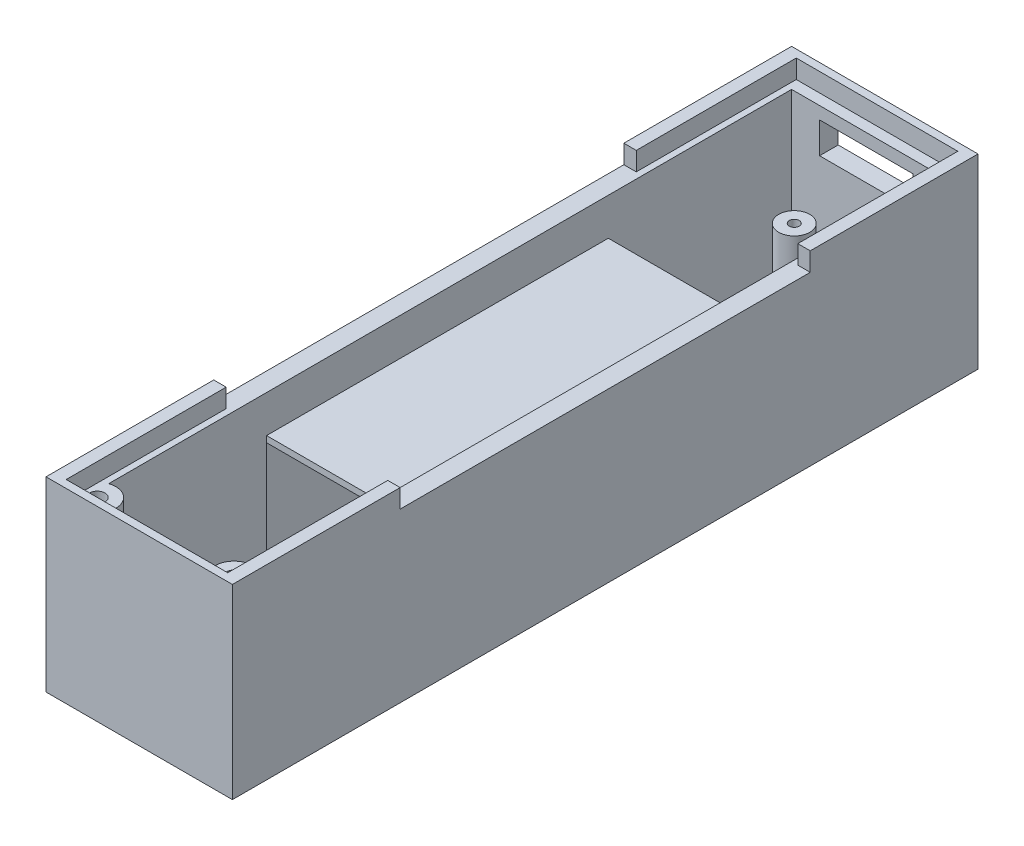
from build123d import *

# Parameters (mm, degrees)
SKETCH1_W                   = 30
SKETCH1_H                   = 120
BOSS_EXTRUDE1_DEPTH         = 30
SKETCH3_W                   = 24
SKETCH3_H                   = 114
CUT_EXTRUDE1_DEPTH          = 27.5
SKETCH4_W                   = 26
SKETCH4_H                   = 117.5
CUT_EXTRUDE2_DEPTH          = 3
SKETCH5_W                   = 66
SKETCH5_H                   = 3
CUT_EXTRUDE3_DEPTH          = 74.484692283
SKETCH6_W                   = 25
SKETCH6_H                   = 55
CUT_EXTRUDE4_DEPTH          = 20
SKETCH8_W                   = 24
SKETCH8_H                   = 55
BOSS_EXTRUDE2_DEPTH         = 1
SKETCH9_W                   = 15
SKETCH9_H                   = 5
CUT_EXTRUDE5_DEPTH          = 3
SKETCH10_R                  = 2.5
BOSS_EXTRUDE3_DEPTH         = 10
BOSS_EXTRUDE4_DEPTH         = 24.5
M2X0_4_TAPPED_HOLE1_D       = 1.6
M2X0_4_TAPPED_HOLE1_DEPTH   = 5.2
M2X0_4_TAPPED_HOLE1_TIP     = 0.480688495
TAP_DRILL_FOR_M3X0_5_TAP2_D = 2.5
SKETCH22_W                  = 8
SKETCH22_H                  = 15
CUT_EXTRUDE6_DEPTH          = 68.684931853


with BuildPart() as part:
    # Sketch1 → Boss-Extrude1 (new body)
    with BuildSketch(Plane(origin=(0, 0, 0), x_dir=(1, 0, 0), z_dir=(0, 1, 0))):
        Rectangle(SKETCH1_W, SKETCH1_H)
    extrude(amount=BOSS_EXTRUDE1_DEPTH)

    # Sketch3 → Cut-Extrude1 (cut)
    with BuildSketch(Plane(origin=(0, 30, 0), x_dir=(1, 0, 0), z_dir=(0, 1, 0))):
        Rectangle(SKETCH3_W, SKETCH3_H)
    extrude(amount=-CUT_EXTRUDE1_DEPTH, mode=Mode.SUBTRACT)

    # Sketch4 → Cut-Extrude2 (cut)
    with BuildSketch(Plane(origin=(0, 30, 0), x_dir=(1, 0, 0), z_dir=(0, 1, 0))):
        Rectangle(SKETCH4_W, SKETCH4_H)
    extrude(amount=-CUT_EXTRUDE2_DEPTH, mode=Mode.SUBTRACT)

    # Sketch5 → Cut-Extrude3 (cut, through all)
    with BuildSketch(Plane(origin=(15, 0, 0), x_dir=(0, 0, -1), z_dir=(1, 0, 0))):
        with Locations((0, 28.5)):
            Rectangle(SKETCH5_W, SKETCH5_H)
    extrude(amount=-CUT_EXTRUDE3_DEPTH, mode=Mode.SUBTRACT)

    # Sketch6 → Cut-Extrude4 (cut)
    with BuildSketch(Plane.XZ):
        Rectangle(SKETCH6_W, SKETCH6_H)
    extrude(amount=-CUT_EXTRUDE4_DEPTH, mode=Mode.SUBTRACT)

    # Sketch8 → Boss-Extrude2 (add)
    with BuildSketch(Plane.XZ.offset(-20)):
        Rectangle(SKETCH8_W, SKETCH8_H)
    extrude(amount=-BOSS_EXTRUDE2_DEPTH)

    # Sketch9 → Cut-Extrude5 (cut)
    with BuildSketch(Plane(origin=(0, 0, -60), x_dir=(-1, 0, 0), z_dir=(0, 0, -1))):
        with Locations((0, 22.5)):
            Rectangle(SKETCH9_W, SKETCH9_H)
    extrude(amount=-CUT_EXTRUDE5_DEPTH, mode=Mode.SUBTRACT)

    # Sketch10 → Boss-Extrude3 (add)
    with BuildSketch(Plane(origin=(0, 2.5, 0), x_dir=(1, 0, 0), z_dir=(0, 1, 0))):
        with Locations(Location((-7.62, 31.455, 0), (0, 0, 90))):
            Circle(SKETCH10_R)
        with Locations(Location((-7.62, 53.045, 0), (0, 0, 90))):
            Circle(SKETCH10_R)
        with Locations(Location((7.62, 53.045, 0), (0, 0, 90))):
            Circle(SKETCH10_R)
        with Locations(Location((7.62, 31.455, 0), (0, 0, 90))):
            Circle(SKETCH10_R)
    extrude(amount=BOSS_EXTRUDE3_DEPTH)

    # Sketch13 → Boss-Extrude4 (add)
    with BuildSketch(Plane(origin=(0, 27, 0), x_dir=(1, 0, 0), z_dir=(0, 1, 0))):
        with BuildLine():
            Line((-12, -52.921572875), (-12, -57))
            Line((-12, -57), (-8.272821971, -57))
            ThreePointArc((-8.272821971, -57), (-8.785462139, -53.726186258), (-12, -52.921572875))
        make_face()
        with BuildLine():
            Line((12, -57), (8.272821971, -57))
            ThreePointArc((8.272821971, -57), (8.785462139, -53.726186258), (12, -52.921572875))
            Line((12, -52.921572875), (12, -57))
        make_face()
    extrude(amount=-BOSS_EXTRUDE4_DEPTH)

    # M2x0.4 Tapped Hole1
    with Locations(Plane(origin=(0, 12.5, 0), x_dir=(1, 0, 0), z_dir=(0, 1, 0))):
        with Locations((-7.62, 31.455), (-7.62, 53.045), (7.62, 53.045), (7.62, 31.455)):
            Hole(M2X0_4_TAPPED_HOLE1_D / 2, depth=M2X0_4_TAPPED_HOLE1_DEPTH)
            with Locations((0, 0, -(M2X0_4_TAPPED_HOLE1_DEPTH + M2X0_4_TAPPED_HOLE1_TIP / 2))):  # 118° drill point
                Cone(0, M2X0_4_TAPPED_HOLE1_D / 2, M2X0_4_TAPPED_HOLE1_TIP, mode=Mode.SUBTRACT)

    # Tap Drill for M3x0.5 Tap2 (through all)
    with Locations(Plane(origin=(0, 27, 0), x_dir=(1, 0, 0), z_dir=(0, 1, 0))):
        with Locations((-11, -55.75), (11, -55.75)):
            Hole(TAP_DRILL_FOR_M3X0_5_TAP2_D / 2)

    # Sketch22 → Cut-Extrude6 (cut, through all)
    with BuildSketch(Plane(origin=(0, 2.5, 0), x_dir=(1, 0, 0), z_dir=(0, 1, 0))):
        with Locations((0, -49.5)):
            Rectangle(SKETCH22_W, SKETCH22_H)
    extrude(amount=-CUT_EXTRUDE6_DEPTH, mode=Mode.SUBTRACT)


solid = part.part
